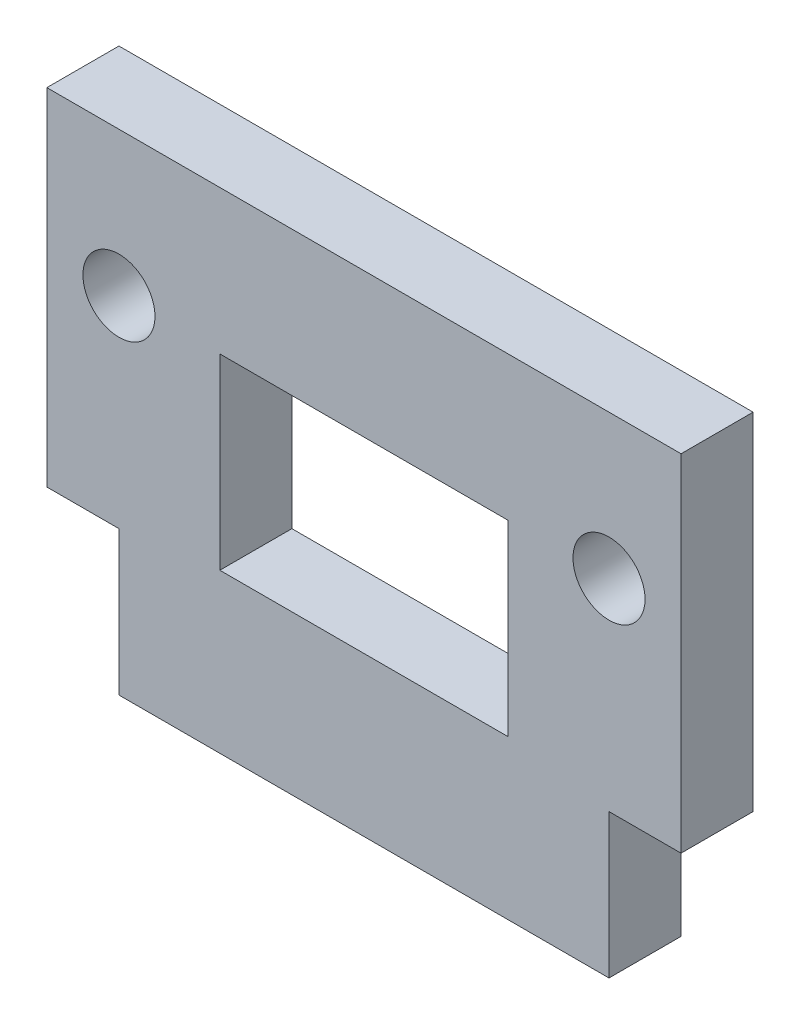
from build123d import *

# Parameters (mm, degrees)
SKETCH1_R           = 1.25
SKETCH1_W           = 10
SKETCH1_H           = 6.5
BOSS_EXTRUDE1_DEPTH = 2.5


with BuildPart() as part:
    # Sketch1 → Boss-Extrude1 (new body)
    with BuildSketch(Plane.XY):
        Polygon((-8.5, -12), (-8.5, -17), (8.5, -17), (8.5, -12), (11, -12), (11, 0), (-11, 0), (-11, -12), align=None)
        with Locations((-8.5, -5)):
            Circle(SKETCH1_R, mode=Mode.SUBTRACT)
        with Locations((8.5, -5)):
            Circle(SKETCH1_R, mode=Mode.SUBTRACT)
        with Locations((0, -8.25)):
            Rectangle(SKETCH1_W, SKETCH1_H, mode=Mode.SUBTRACT)
    extrude(amount=BOSS_EXTRUDE1_DEPTH)


solid = part.part
